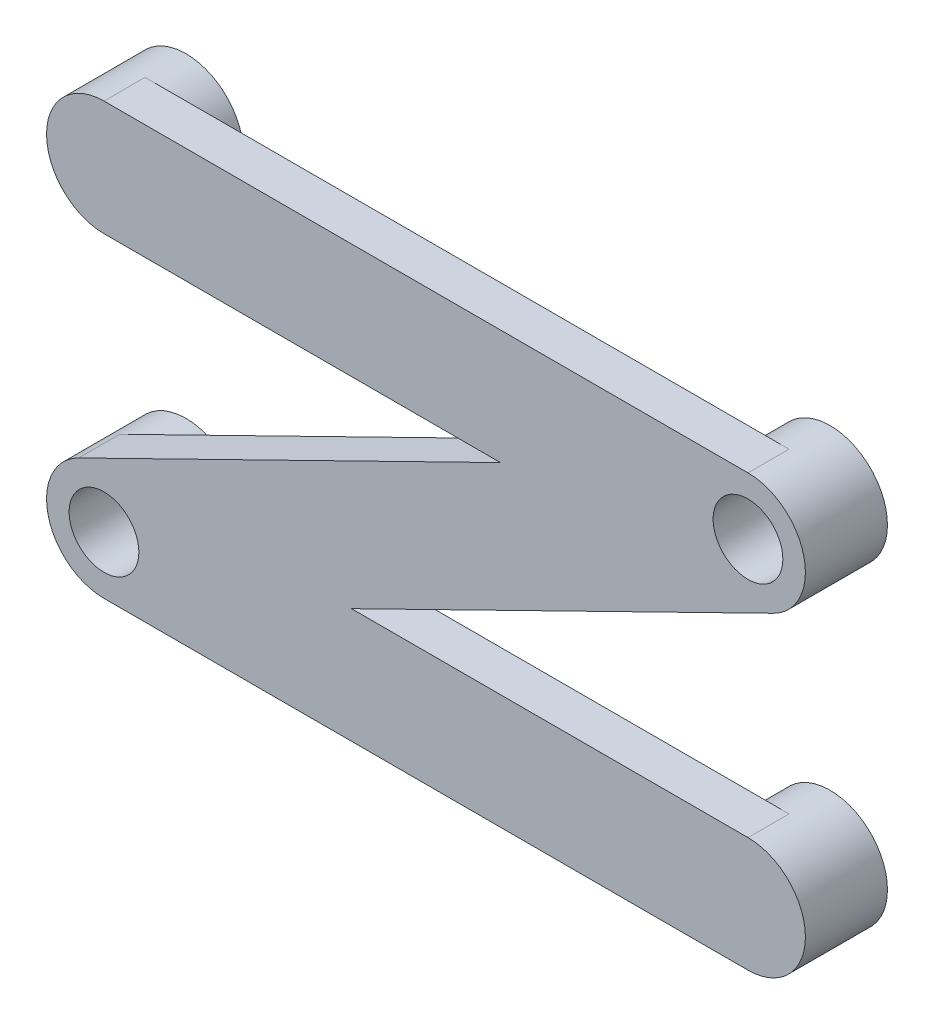
from build123d import *

# Parameters (mm, degrees)
EXTRUDE_1007_DEPTH = 2
SKETCH_1_5_R       = 2.8
SKETCH_1_5_R_2     = 1.7
EXTRUDE_1106_DEPTH = 4


with BuildPart() as part:
    # Эскиз1 → Extrude 1007 (new body)
    with BuildSketch(Plane.XY):
        with BuildLine():
            Line((15.7, 10.5), (-15.7, 10.5))
            ThreePointArc((-15.7, 10.5), (-13.720101013, 9.679898987), (-12.9, 7.7))
            ThreePointArc((-12.9, 7.7), (-13.720101013, 5.720101013), (-15.7, 4.9))
            Line((-15.7, 4.9), (3.632157719, 4.9))
            Line((3.632157719, 4.9), (-16.932946461, -5.186070203))
            ThreePointArc((-16.932946461, -5.186070203), (-14.218826494, -5.323842378), (-12.9, -7.7))
            ThreePointArc((-12.9, -7.7), (-13.720101013, -9.679898987), (-15.7, -10.5))
            Line((-15.7, -10.5), (15.7, -10.5))
            ThreePointArc((15.7, -10.5), (12.9, -7.7), (15.7, -4.9))
            Line((15.7, -4.9), (-3.632157719, -4.9))
            Line((-3.632157719, -4.9), (16.932946461, 5.186070203))
            ThreePointArc((16.932946461, 5.186070203), (12.972455002, 7.067150662), (15.7, 10.5))
        make_face()
    extrude(amount=-EXTRUDE_1007_DEPTH)

    # Эскиз1<5> → Extrude 1106 (add)
    # profile 1 of 4: a face of its own
    with BuildSketch(Plane.XY):
        with Locations((-15.7, 7.7)):
            Circle(SKETCH_1_5_R)
    # profile 2 of 4: a face of its own
    with BuildSketch(Plane.XY):
        with Locations((15.7, 7.7)):
            Circle(SKETCH_1_5_R)
        with Locations((15.7, 7.7)):
            Circle(SKETCH_1_5_R_2, mode=Mode.SUBTRACT)
    # profile 3 of 4: a face of its own
    with BuildSketch(Plane.XY):
        with Locations((-15.7, -7.7)):
            Circle(SKETCH_1_5_R)
        with Locations((-15.7, -7.7)):
            Circle(SKETCH_1_5_R_2, mode=Mode.SUBTRACT)
    # profile 4 of 4: a face of its own
    with BuildSketch(Plane.XY):
        with Locations((15.7, -7.7)):
            Circle(SKETCH_1_5_R)
    extrude(amount=-EXTRUDE_1106_DEPTH)


solid = part.part
